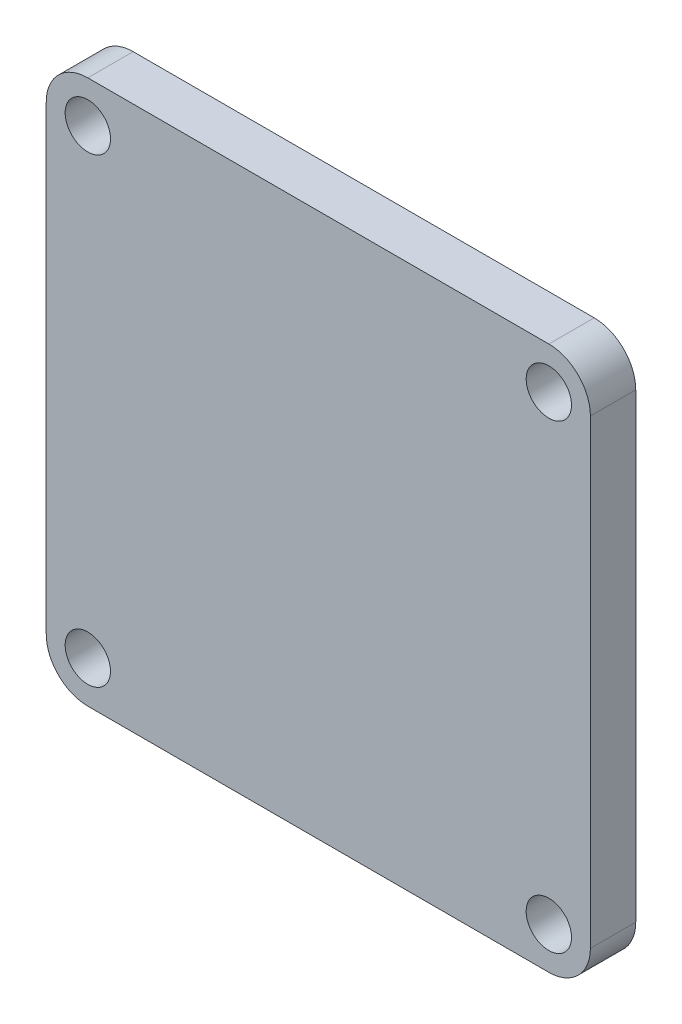
from build123d import *

# Parameters (mm, degrees)
SKETCH_1_R      = 1.5
EXTRUDE_1_DEPTH = 3


with BuildPart() as part:
    # 草图1 → 凸台-拉伸1 (new body)
    with BuildSketch(Plane.XY):
        with BuildLine():
            Line((-15.25, 18), (15.25, 18))
            ThreePointArc((15.25, 18), (17.194543648, 17.194543648), (18, 15.25))
            Line((18, 15.25), (18, -15.25))
            ThreePointArc((18, -15.25), (17.194543648, -17.194543648), (15.25, -18))
            Line((15.25, -18), (-15.25, -18))
            ThreePointArc((-15.25, -18), (-17.194543648, -17.194543648), (-18, -15.25))
            Line((-18, -15.25), (-18, 15.25))
            ThreePointArc((-18, 15.25), (-17.194543648, 17.194543648), (-15.25, 18))
        make_face()
        with Locations((-15.25, 15.25)):
            Circle(SKETCH_1_R, mode=Mode.SUBTRACT)
        with Locations(Location((15.25, 15.25, 0), (0, 0, 180))):
            Circle(SKETCH_1_R, mode=Mode.SUBTRACT)
        with Locations((15.25, -15.25)):
            Circle(SKETCH_1_R, mode=Mode.SUBTRACT)
        with Locations(Location((-15.25, -15.25, 0), (0, 0, 180))):
            Circle(SKETCH_1_R, mode=Mode.SUBTRACT)
    extrude(amount=EXTRUDE_1_DEPTH)


solid = part.part
